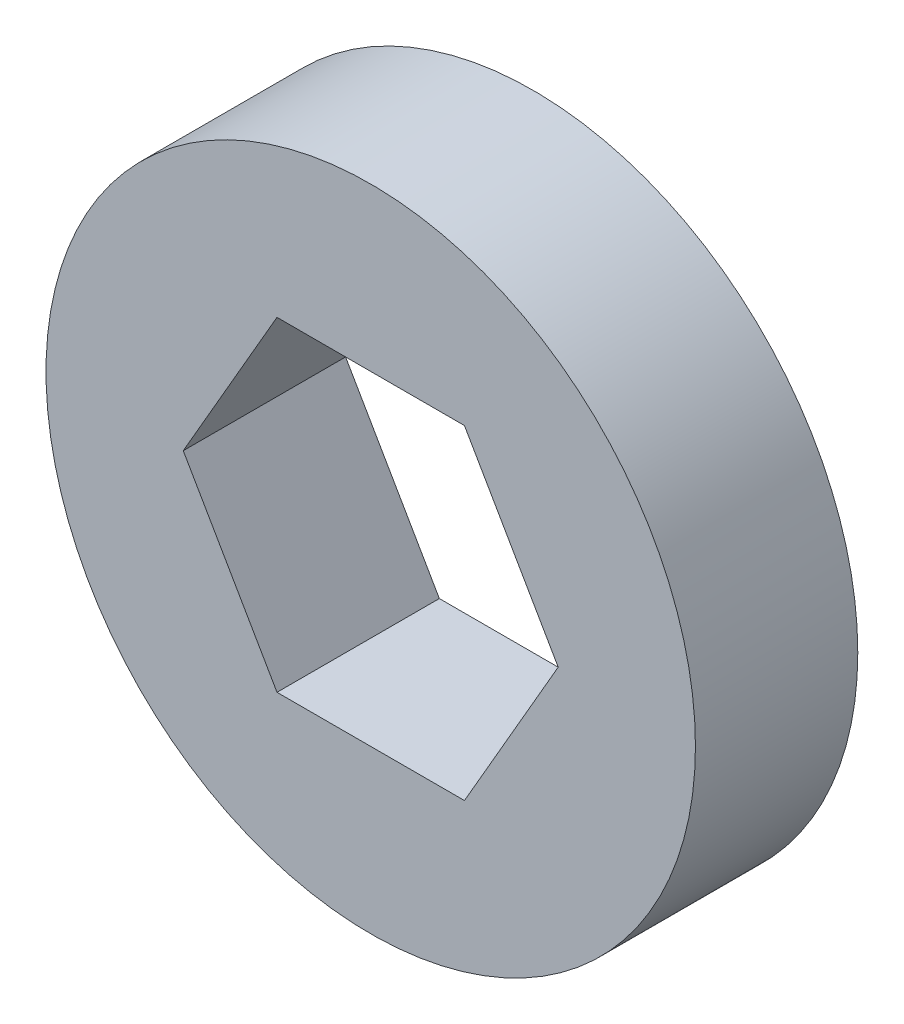
from build123d import *

# Parameters (mm, degrees)
SKETCH1_R           = 12.7
BOSS_EXTRUDE1_DEPTH = 6.35


with BuildPart() as part:
    # Sketch1 → Boss-Extrude1 (new body)
    with BuildSketch(Plane.XY):
        Circle(SKETCH1_R)
        Polygon((7.332348419, 0), (3.666174209, 6.35), (-3.666174209, 6.35), (-7.332348419, 0), (-3.666174209, -6.35), (3.666174209, -6.35), align=None, mode=Mode.SUBTRACT)
    extrude(amount=BOSS_EXTRUDE1_DEPTH)


solid = part.part
